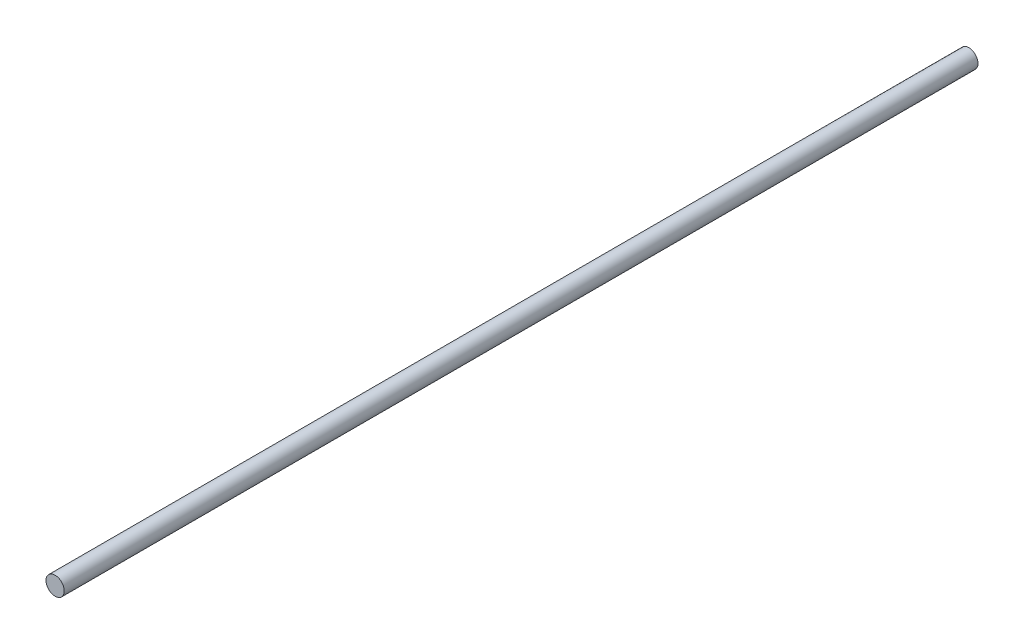
from build123d import *

# Parameters (mm, degrees)
ESQUISSE1_R        = 1
BOSS_EXTRU_1_DEPTH = 100


with BuildPart() as part:
    # Esquisse1 → Boss.-Extru.1 (new body)
    with BuildSketch(Plane.XY):
        Circle(ESQUISSE1_R)
    extrude(amount=BOSS_EXTRU_1_DEPTH)


solid = part.part
